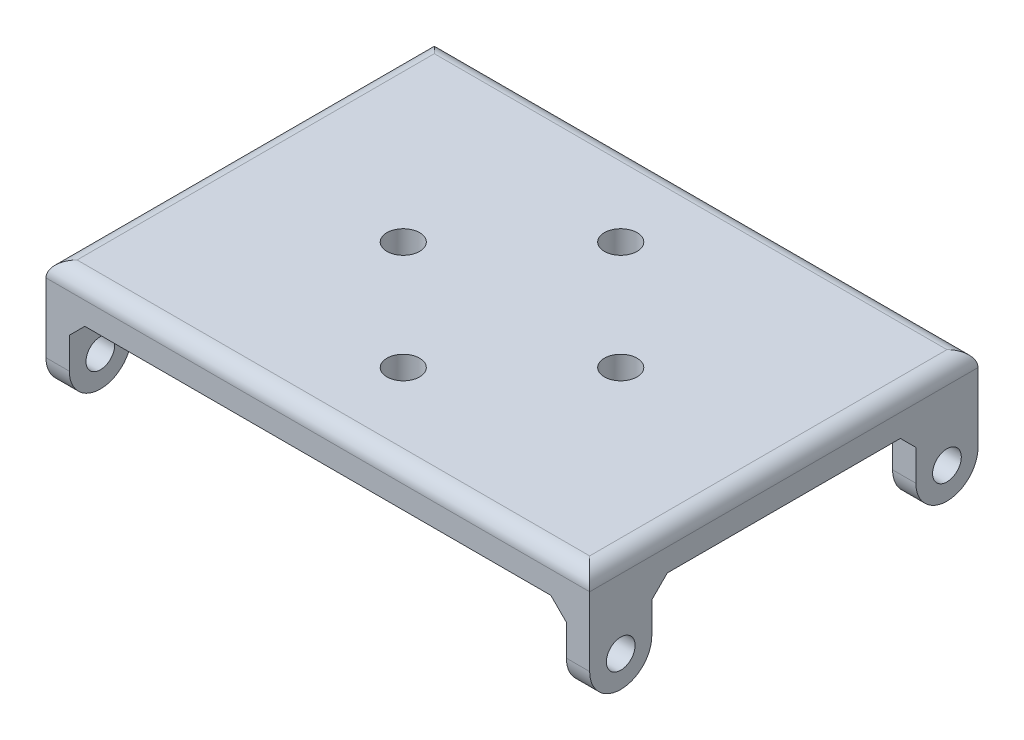
from build123d import *

# Parameters (mm, degrees)
SKETCH_1_W          = 35
SKETCH_1_H          = 25
EXTRUDE_1_DEPTH     = 1.225
EXTRUDE_2_DEPTH     = 1.5
SKETCH_4_R          = 0.925
CUT_EXTRUDE_1_DEPTH = 38.682895656
CHAMFER_1_SIZE      = 1
FILLET_1_R          = 1
SKETCH_5_R          = 1.05
CUT_EXTRUDE_2_DEPTH = 23.759668275


with BuildPart() as part:
    # 草图1 → 凸台-拉伸1 (new, symmetric)
    with BuildSketch(Plane(origin=(0, 0, 0), x_dir=(1, 0, 0), z_dir=(0, 1, 0))):
        Rectangle(SKETCH_1_W, SKETCH_1_H)
    extrude(amount=EXTRUDE_1_DEPTH, both=True)

    # 草图2 → 凸台-拉伸2 (add)
    with BuildSketch(Plane.ZY.offset(17.5)):
        with BuildLine():
            Line((-12.5, -1.225), (-12.5, -4.225))
            ThreePointArc((-12.5, -4.225), (-10.5, -6.225), (-8.5, -4.225))
            Line((-8.5, -4.225), (-8.5, -1.225))
            Line((-8.5, -1.225), (-12.5, -1.225))
        make_face()
        with BuildLine():
            Line((8.5, -1.225), (12.5, -1.225))
            Line((12.5, -1.225), (12.5, -4.225))
            ThreePointArc((12.5, -4.225), (10.5, -6.225), (8.5, -4.225))
            Line((8.5, -4.225), (8.5, -1.225))
        make_face()
    extrude_2 = extrude(amount=-EXTRUDE_2_DEPTH)

    # 草图4 → 切除-拉伸1 (cut, through all)
    with BuildSketch(Plane.ZY.offset(17.5)):
        with Locations((-10.5, -4.225)):
            Circle(SKETCH_4_R)
        with Locations(Location((10.5, -4.225, 0), (0, 0, 180))):
            Circle(SKETCH_4_R)
    cut_extrude_1 = extrude(amount=-CUT_EXTRUDE_1_DEPTH, mode=Mode.SUBTRACT)

    # 镜向1: 凸台-拉伸2, 切除-拉伸1 across plane
    add(extrude_2.mirror(Plane(origin=(0, 0, 0), x_dir=(0, 0, 1), z_dir=(1, 0, 0))))
    add(cut_extrude_1.mirror(Plane(origin=(0, 0, 0), x_dir=(0, 0, 1), z_dir=(1, 0, 0))), mode=Mode.SUBTRACT)

    # 倒角1
    chamfer_1_edges = [part.edges().sort_by_distance(p)[0] for p in [
        (-16, -1.225, -10.5),
        (-16.75, -1.225, -8.5),
        (-16, -1.225, 10.5),
        (-16.75, -1.225, 8.5),
        (16.75, -1.225, -8.5),
        (16, -1.225, -10.5),
        (16.75, -1.225, 8.5),
        (16, -1.225, 10.5),
    ]]
    chamfer(chamfer_1_edges, length=CHAMFER_1_SIZE)

    # 圆角1
    fillet_1_edges = [part.edges().sort_by_distance(p)[0] for p in [
        (-17.5, 1.225, 0),
        (0, 1.225, 12.5),
        (17.5, 1.225, 0),
        (0, 1.225, -12.5),
    ]]
    fillet(fillet_1_edges, radius=FILLET_1_R)

    # 草图5 → 切除-拉伸2 (cut, through all)
    with BuildSketch(Plane(origin=(0, 1.225, 0), x_dir=(1, 0, 0), z_dir=(0, 1, 0))):
        with Locations(Location((0, 7, 0), (0, 0, 270))):
            Circle(SKETCH_5_R)
        with Locations(Location((7, 0, 0), (0, 0, 270))):
            Circle(SKETCH_5_R)
        with Locations(Location((-7, 0, 0), (0, 0, 270))):
            Circle(SKETCH_5_R)
        with Locations(Location((0, -7, 0), (0, 0, 270))):
            Circle(SKETCH_5_R)
    extrude(amount=-CUT_EXTRUDE_2_DEPTH, mode=Mode.SUBTRACT)


solid = part.part
